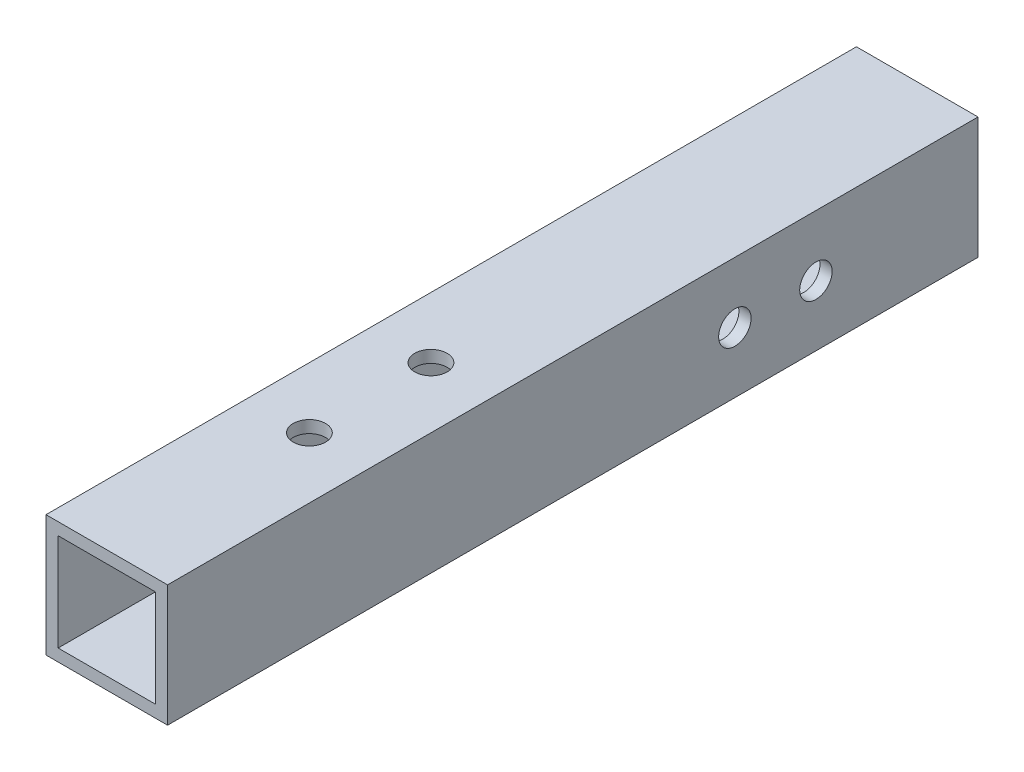
from build123d import *

# Parameters (mm, degrees)
SKETCH_1_W          = 15
SKETCH_1_H          = 15
SKETCH_1_W_2        = 12
SKETCH_1_H_2        = 12
EXTRUDE_1_DEPTH     = 100
SKETCH_4_R          = 2
CUT_EXTRUDE_2_DEPTH = 75
SKETCH_5_R          = 2
CUT_EXTRUDE_3_DEPTH = 102.396498953


with BuildPart() as part:
    # 草图1 → 凸台-拉伸1 (new body)
    with BuildSketch(Plane.XY):
        Rectangle(SKETCH_1_W, SKETCH_1_H)
        Rectangle(SKETCH_1_W_2, SKETCH_1_H_2, mode=Mode.SUBTRACT)
    extrude(amount=EXTRUDE_1_DEPTH)

    # 草图4 → 切除-拉伸2 (cut)
    with BuildSketch(Plane.XZ.offset(7.5)):
        with Locations(Location((0, 75, 0), (0, 0, 270))):
            Circle(SKETCH_4_R)
        with Locations(Location((0, 60, 0), (0, 0, 270))):
            Circle(SKETCH_4_R)
    extrude(amount=-CUT_EXTRUDE_2_DEPTH, mode=Mode.SUBTRACT)

    # 草图5 → 切除-拉伸3 (cut, through all)
    with BuildSketch(Plane.ZY.offset(7.5)):
        with Locations((20, 0)):
            Circle(SKETCH_5_R)
        with Locations((30, 0)):
            Circle(SKETCH_5_R)
    extrude(amount=-CUT_EXTRUDE_3_DEPTH, mode=Mode.SUBTRACT)


solid = part.part
